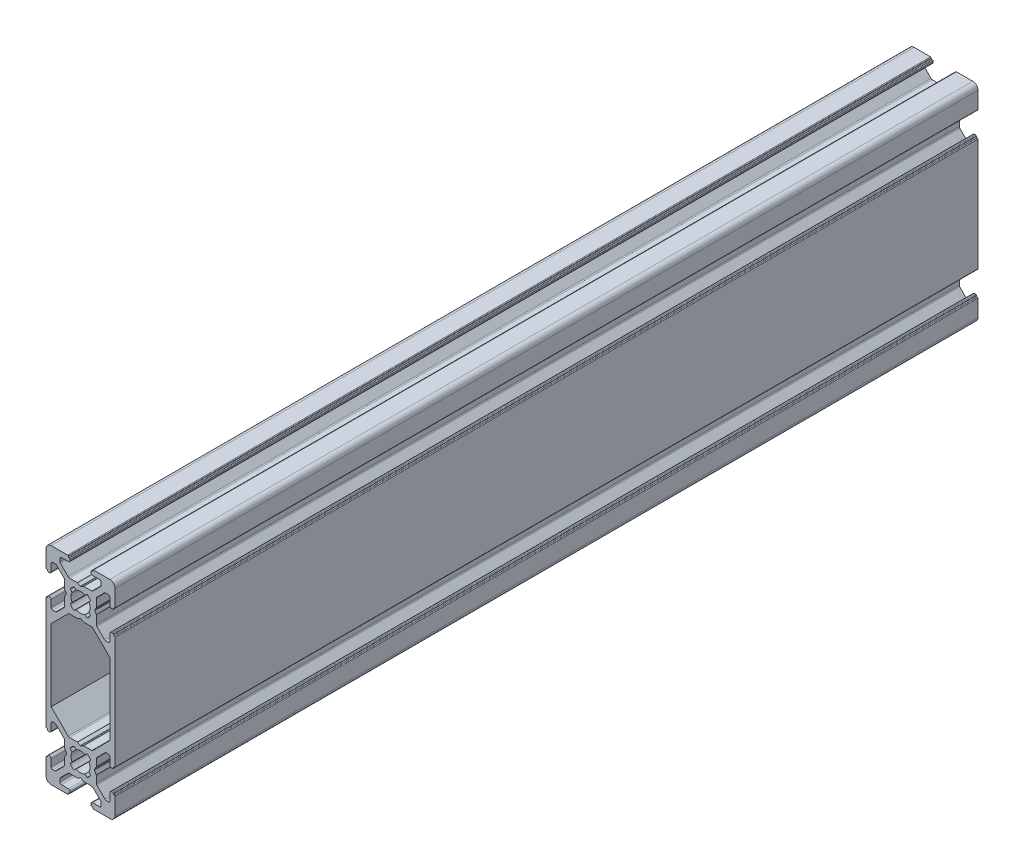
from build123d import *

# Parameters (mm, degrees)
EXTRUDE1_DEPTH = 250


with BuildPart() as part:
    # Sketch2 → Extrude1 (new body)
    with BuildSketch(Plane.XY):
        with BuildLine():
            Line((-9.99999992, 36.255782504), (-9.99999992, 8.499999759))
            Line((-9.99999992, 8.499999759), (-9.99999992, 3.75))
            ThreePointArc((-9.99999992, 3.75), (-9.941421276, 3.608578644), (-9.79999992, 3.55))
            Line((-9.79999992, 3.55), (-9.69999992, 3.55))
            ThreePointArc((-9.69999992, 3.55), (-9.558578564, 3.491421356), (-9.49999992, 3.35))
            Line((-9.49999992, 3.35), (-9.49999992, 3.2))
            ThreePointArc((-9.49999992, 3.2), (-9.441421276, 3.058578644), (-9.29999992, 3))
            Line((-9.29999992, 3), (-8.99999992, 3))
            ThreePointArc((-8.99999992, 3), (-8.646446529, 3.146446609), (-8.49999992, 3.5))
            Line((-8.49999992, 3.5), (-8.49999992, 5.5))
            ThreePointArc((-8.49999992, 5.5), (-8.353553311, 5.853553391), (-7.99999992, 6))
            Line((-7.99999992, 6), (-7.467766346, 6))
            ThreePointArc((-7.467766346, 6), (-7.27642463, 5.961939766), (-7.114212955, 5.853553391))
            Line((-7.114212955, 5.853553391), (-4.721446323, 3.460786758))
            ThreePointArc((-4.721446323, 3.460786758), (-4.613059947, 3.298575084), (-4.574999713, 3.107233367))
            Line((-4.574999713, 3.107233367), (-4.574999713, 1.083493192))
            ThreePointArc((-4.574999713, 1.083493192), (-4.568184878, 1.031729383), (-4.548204794, 0.983493192))
            Line((-4.548204794, 0.983493192), (-4.038119761, 0.1))
            ThreePointArc((-4.038119761, 0.1), (-4.011324842, 0), (-4.038119761, -0.1))
            Line((-4.038119761, -0.1), (-4.548204794, -0.983493192))
            ThreePointArc((-4.548204794, -0.983493192), (-4.568184878, -1.031729383), (-4.574999713, -1.083493192))
            Line((-4.574999713, -1.083493192), (-4.574999713, -3.107233367))
            ThreePointArc((-4.574999713, -3.107233367), (-4.613059947, -3.298575084), (-4.721446323, -3.460786758))
            Line((-4.721446323, -3.460786758), (-7.114212955, -5.853553391))
            ThreePointArc((-7.114212955, -5.853553391), (-7.27642463, -5.961939766), (-7.467766346, -6))
            Line((-7.467766346, -6), (-7.99999992, -6))
            ThreePointArc((-7.99999992, -6), (-8.353553311, -5.853553391), (-8.49999992, -5.5))
            Line((-8.49999992, -5.5), (-8.49999992, -3.5))
            ThreePointArc((-8.49999992, -3.5), (-8.646446529, -3.146446609), (-8.99999992, -3))
            Line((-8.99999992, -3), (-9.29999992, -3))
            ThreePointArc((-9.29999992, -3), (-9.441421276, -3.058578644), (-9.49999992, -3.2))
            Line((-9.49999992, -3.2), (-9.49999992, -3.35))
            ThreePointArc((-9.49999992, -3.35), (-9.558578564, -3.491421356), (-9.69999992, -3.55))
            Line((-9.69999992, -3.55), (-9.79999992, -3.55))
            ThreePointArc((-9.79999992, -3.55), (-9.941421276, -3.608578644), (-9.99999992, -3.75))
            Line((-9.99999992, -3.75), (-9.99999992, -8.5))
            ThreePointArc((-9.99999992, -8.5), (-9.560660092, -9.560660172), (-8.49999992, -10))
            Line((-8.49999992, -10), (-3.74999992, -10))
            ThreePointArc((-3.74999992, -10), (-3.608578564, -9.941421356), (-3.54999992, -9.8))
            Line((-3.54999992, -9.8), (-3.54999992, -9.7))
            ThreePointArc((-3.54999992, -9.7), (-3.491421276, -9.558578644), (-3.34999992, -9.5))
            Line((-3.34999992, -9.5), (-3.2, -9.5))
            ThreePointArc((-3.2, -9.5), (-3.058578644, -9.441421356), (-3, -9.3))
            Line((-3, -9.3), (-3, -9))
            ThreePointArc((-3, -9), (-3.146446609, -8.646446609), (-3.5, -8.5))
            Line((-3.5, -8.5), (-5.5, -8.5))
            ThreePointArc((-5.5, -8.5), (-5.853553391, -8.353553391), (-6, -8))
            Line((-6, -8), (-6, -7.267766929))
            ThreePointArc((-6, -7.267766929), (-5.961939766, -7.076425212), (-5.853553391, -6.914213538))
            Line((-5.853553391, -6.914213538), (-3.585786494, -4.646446642))
            ThreePointArc((-3.585786494, -4.646446642), (-3.42357482, -4.538060266), (-3.232233104, -4.500000032))
            Line((-3.232233104, -4.500000032), (-0.953589838, -4.500000032))
            ThreePointArc((-0.953589838, -4.500000032), (-0.901826029, -4.493185198), (-0.853589838, -4.473205113))
            Line((-0.853589838, -4.473205113), (-0.1, -4.038119817))
            ThreePointArc((-0.1, -4.038119817), (0, -4.011324898), (0.1, -4.038119817))
            Line((0.1, -4.038119817), (0.853589838, -4.473205113))
            ThreePointArc((0.853589838, -4.473205113), (0.901826029, -4.493185198), (0.953589838, -4.500000032))
            Line((0.953589838, -4.500000032), (3.232233104, -4.500000032))
            ThreePointArc((3.232233104, -4.500000032), (3.42357482, -4.538060266), (3.585786494, -4.646446642))
            Line((3.585786494, -4.646446642), (5.853553391, -6.914213538))
            ThreePointArc((5.853553391, -6.914213538), (5.961939766, -7.076425212), (6, -7.267766929))
            Line((6, -7.267766929), (6, -8))
            ThreePointArc((6, -8), (5.853553391, -8.353553391), (5.5, -8.5))
            Line((5.5, -8.5), (3.5, -8.5))
            ThreePointArc((3.5, -8.5), (3.146446609, -8.646446609), (3, -9))
            Line((3, -9), (3, -9.3))
            ThreePointArc((3, -9.3), (3.058578644, -9.441421356), (3.2, -9.5))
            Line((3.2, -9.5), (3.34999992, -9.5))
            ThreePointArc((3.34999992, -9.5), (3.491421276, -9.558578644), (3.54999992, -9.7))
            Line((3.54999992, -9.7), (3.54999992, -9.8))
            ThreePointArc((3.54999992, -9.8), (3.608578564, -9.941421356), (3.74999992, -10))
            Line((3.74999992, -10), (8.49999992, -10))
            ThreePointArc((8.49999992, -10), (9.560660092, -9.560660172), (9.99999992, -8.5))
            Line((9.99999992, -8.5), (9.99999992, -3.7))
            ThreePointArc((9.99999992, -3.7), (9.941421276, -3.558578644), (9.79999992, -3.5))
            Line((9.79999992, -3.5), (9.69999992, -3.5))
            ThreePointArc((9.69999992, -3.5), (9.558578564, -3.441421356), (9.49999992, -3.3))
            Line((9.49999992, -3.3), (9.49999992, -3.2))
            ThreePointArc((9.49999992, -3.2), (9.441421276, -3.058578644), (9.29999992, -3))
            Line((9.29999992, -3), (8.99999992, -3))
            ThreePointArc((8.99999992, -3), (8.646446529, -3.146446609), (8.49999992, -3.5))
            Line((8.49999992, -3.5), (8.49999992, -5.499999866))
            ThreePointArc((8.49999992, -5.499999866), (8.353553271, -5.853553351), (7.999999786, -6))
            Line((7.999999786, -6), (7.467766346, -6))
            ThreePointArc((7.467766346, -6), (7.27642463, -5.961939766), (7.114212955, -5.853553391))
            Line((7.114212955, -5.853553391), (4.721446323, -3.460786758))
            ThreePointArc((4.721446323, -3.460786758), (4.613059947, -3.298575084), (4.574999713, -3.107233367))
            Line((4.574999713, -3.107233367), (4.574999713, -1.083493446))
            ThreePointArc((4.574999713, -1.083493446), (4.568184878, -1.031729637), (4.548204794, -0.983493446))
            Line((4.548204794, -0.983493446), (4.038119615, -0.1))
            ThreePointArc((4.038119615, -0.1), (4.011324696, 0), (4.038119615, 0.1))
            Line((4.038119615, 0.1), (4.548204794, 0.983493446))
            ThreePointArc((4.548204794, 0.983493446), (4.568184878, 1.031729637), (4.574999713, 1.083493446))
            Line((4.574999713, 1.083493446), (4.574999713, 3.107233367))
            ThreePointArc((4.574999713, 3.107233367), (4.613059947, 3.298575084), (4.721446323, 3.460786758))
            Line((4.721446323, 3.460786758), (7.114212955, 5.853553391))
            ThreePointArc((7.114212955, 5.853553391), (7.27642463, 5.961939766), (7.467766346, 6))
            Line((7.467766346, 6), (7.999999786, 6))
            ThreePointArc((7.999999786, 6), (8.353553177, 5.853553391), (8.499999786, 5.5))
            Line((8.499999786, 5.5), (8.499999786, 3.5))
            ThreePointArc((8.499999786, 3.5), (8.646446395, 3.146446609), (8.999999786, 3))
            Line((8.999999786, 3), (9.299999961, 3))
            ThreePointArc((9.299999961, 3), (9.441421317, 3.058578644), (9.499999961, 3.2))
            Line((9.499999961, 3.2), (9.499999961, 3.3))
            ThreePointArc((9.499999961, 3.3), (9.558578605, 3.441421356), (9.699999961, 3.5))
            Line((9.699999961, 3.5), (9.79999992, 3.5))
            ThreePointArc((9.79999992, 3.5), (9.941421276, 3.558578644), (9.99999992, 3.7))
            Line((9.99999992, 3.7), (9.99999992, 8.500000326))
            Line((9.99999992, 8.500000326), (9.99999992, 36.255782504))
            ThreePointArc((9.99999992, 36.255782504), (9.941421276, 36.39720386), (9.79999992, 36.455782504))
            Line((9.79999992, 36.455782504), (9.69999992, 36.455782504))
            ThreePointArc((9.69999992, 36.455782504), (9.558578564, 36.514361147), (9.49999992, 36.655782504))
            Line((9.49999992, 36.655782504), (9.49999992, 36.755782504))
            ThreePointArc((9.49999992, 36.755782504), (9.441421276, 36.89720386), (9.29999992, 36.955782504))
            Line((9.29999992, 36.955782504), (8.99999992, 36.955782504))
            ThreePointArc((8.99999992, 36.955782504), (8.646446529, 36.809335894), (8.49999992, 36.455782504))
            Line((8.49999992, 36.455782504), (8.49999992, 34.505782744))
            ThreePointArc((8.49999992, 34.505782744), (8.353553311, 34.152229354), (7.99999992, 34.005782744))
            Line((7.99999992, 34.005782744), (7.267766873, 34.005782744))
            ThreePointArc((7.267766873, 34.005782744), (7.076425157, 34.043842978), (6.914213482, 34.152229354))
            Line((6.914213482, 34.152229354), (4.721446323, 36.344996513))
            ThreePointArc((4.721446323, 36.344996513), (4.613059947, 36.507208188), (4.574999713, 36.698549904))
            Line((4.574999713, 36.698549904), (4.574999713, 39.177192543))
            ThreePointArc((4.574999713, 39.177192543), (4.568184878, 39.228956354), (4.548204792, 39.277192547))
            Line((4.548204792, 39.277192547), (4.141986965, 39.980782422))
            ThreePointArc((4.141986965, 39.980782422), (4.115192043, 40.080782422), (4.14198696, 40.180782422))
            Line((4.14198696, 40.180782422), (4.548204796, 40.884372394))
            ThreePointArc((4.548204796, 40.884372394), (4.568184879, 40.932608583), (4.574999713, 40.98437239))
            Line((4.574999713, 40.98437239), (4.574999713, 43.313015505))
            ThreePointArc((4.574999713, 43.313015505), (4.613059942, 43.50435721), (4.721446305, 43.666568878))
            Line((4.721446305, 43.666568878), (6.914213331, 45.859336117))
            ThreePointArc((6.914213331, 45.859336117), (7.076425073, 45.967722531), (7.267766873, 46.005782744))
            Line((7.267766873, 46.005782744), (7.99999992, 46.005782744))
            ThreePointArc((7.99999992, 46.005782744), (8.353553311, 45.859336135), (8.49999992, 45.505782744))
            Line((8.49999992, 45.505782744), (8.49999992, 43.455782504))
            ThreePointArc((8.49999992, 43.455782504), (8.646446529, 43.102229113), (8.99999992, 42.955782504))
            Line((8.99999992, 42.955782504), (9.29999992, 42.955782504))
            ThreePointArc((9.29999992, 42.955782504), (9.441421276, 43.014361147), (9.49999992, 43.155782504))
            Line((9.49999992, 43.155782504), (9.49999992, 43.255782504))
            ThreePointArc((9.49999992, 43.255782504), (9.558578564, 43.39720386), (9.69999992, 43.455782504))
            Line((9.69999992, 43.455782504), (9.79999992, 43.455782504))
            ThreePointArc((9.79999992, 43.455782504), (9.941421276, 43.514361147), (9.99999992, 43.655782504))
            Line((9.99999992, 43.655782504), (9.99999992, 48.49999967))
            ThreePointArc((9.99999992, 48.49999967), (9.560660092, 49.560659842), (8.49999992, 49.99999967))
            Line((8.49999992, 49.99999967), (3.74999992, 49.99999967))
            ThreePointArc((3.74999992, 49.99999967), (3.608578564, 49.941421026), (3.54999992, 49.79999967))
            Line((3.54999992, 49.79999967), (3.54999992, 49.69999967))
            ThreePointArc((3.54999992, 49.69999967), (3.491421276, 49.558578314), (3.34999992, 49.49999967))
            Line((3.34999992, 49.49999967), (3.2, 49.49999967))
            ThreePointArc((3.2, 49.49999967), (3.058578644, 49.441421026), (3, 49.29999967))
            Line((3, 49.29999967), (3, 48.99999967))
            ThreePointArc((3, 48.99999967), (3.146446609, 48.646446279), (3.5, 48.49999967))
            Line((3.5, 48.49999967), (5.5, 48.49999967))
            ThreePointArc((5.5, 48.49999967), (5.853553391, 48.353553061), (6, 47.99999967))
            Line((6, 47.99999967), (6, 47.267766623))
            ThreePointArc((6, 47.267766623), (5.961939766, 47.076424907), (5.853553391, 46.914213232))
            Line((5.853553391, 46.914213232), (3.585786494, 44.646446336))
            ThreePointArc((3.585786494, 44.646446336), (3.42357482, 44.538059961), (3.232233104, 44.499999727))
            Line((3.232233104, 44.499999727), (0.953589697, 44.499999727))
            ThreePointArc((0.953589697, 44.499999727), (0.901825886, 44.493184891), (0.853589693, 44.473204805))
            Line((0.853589693, 44.473204805), (0.059202738, 44.014565257))
            ThreePointArc((0.059202738, 44.014565257), (0, 43.998701931), (-0.059202738, 44.014565257))
            Line((-0.059202738, 44.014565257), (-0.853589693, 44.473204805))
            ThreePointArc((-0.853589693, 44.473204805), (-0.901825886, 44.493184891), (-0.953589697, 44.499999727))
            Line((-0.953589697, 44.499999727), (-3.232233104, 44.499999727))
            ThreePointArc((-3.232233104, 44.499999727), (-3.42357482, 44.538059961), (-3.585786494, 44.646446336))
            Line((-3.585786494, 44.646446336), (-5.853553391, 46.914213232))
            ThreePointArc((-5.853553391, 46.914213232), (-5.961939766, 47.076424907), (-6, 47.267766623))
            Line((-6, 47.267766623), (-6, 47.99999967))
            ThreePointArc((-6, 47.99999967), (-5.853553391, 48.353553061), (-5.5, 48.49999967))
            Line((-5.5, 48.49999967), (-3.5, 48.49999967))
            ThreePointArc((-3.5, 48.49999967), (-3.146446609, 48.646446279), (-3, 48.99999967))
            Line((-3, 48.99999967), (-3, 49.29999967))
            ThreePointArc((-3, 49.29999967), (-3.058578644, 49.441421026), (-3.2, 49.49999967))
            Line((-3.2, 49.49999967), (-3.34999992, 49.49999967))
            ThreePointArc((-3.34999992, 49.49999967), (-3.491421276, 49.558578314), (-3.54999992, 49.69999967))
            Line((-3.54999992, 49.69999967), (-3.54999992, 49.79999967))
            ThreePointArc((-3.54999992, 49.79999967), (-3.608578564, 49.941421026), (-3.74999992, 49.99999967))
            Line((-3.74999992, 49.99999967), (-8.49999992, 49.99999967))
            ThreePointArc((-8.49999992, 49.99999967), (-9.560660092, 49.560659842), (-9.99999992, 48.49999967))
            Line((-9.99999992, 48.49999967), (-9.99999992, 43.655782504))
            ThreePointArc((-9.99999992, 43.655782504), (-9.941421276, 43.514361147), (-9.79999992, 43.455782504))
            Line((-9.79999992, 43.455782504), (-9.69999992, 43.455782504))
            ThreePointArc((-9.69999992, 43.455782504), (-9.558578564, 43.39720386), (-9.49999992, 43.255782504))
            Line((-9.49999992, 43.255782504), (-9.49999992, 43.155782504))
            ThreePointArc((-9.49999992, 43.155782504), (-9.441421276, 43.014361147), (-9.29999992, 42.955782504))
            Line((-9.29999992, 42.955782504), (-8.99999992, 42.955782504))
            ThreePointArc((-8.99999992, 42.955782504), (-8.646446529, 43.102229113), (-8.49999992, 43.455782504))
            Line((-8.49999992, 43.455782504), (-8.49999992, 45.50578261))
            ThreePointArc((-8.49999992, 45.50578261), (-8.353553271, 45.859336095), (-7.999999786, 46.005782744))
            Line((-7.999999786, 46.005782744), (-7.267766739, 46.005782744))
            ThreePointArc((-7.267766739, 46.005782744), (-7.076425012, 45.967722506), (-6.914213331, 45.859336117))
            Line((-6.914213331, 45.859336117), (-4.721446305, 43.666568878))
            ThreePointArc((-4.721446305, 43.666568878), (-4.613059942, 43.50435721), (-4.574999713, 43.313015505))
            Line((-4.574999713, 43.313015505), (-4.574999713, 40.98437239))
            ThreePointArc((-4.574999713, 40.98437239), (-4.568184879, 40.932608583), (-4.548204796, 40.884372394))
            Line((-4.548204796, 40.884372394), (-4.14198696, 40.180782422))
            ThreePointArc((-4.14198696, 40.180782422), (-4.115192043, 40.080782422), (-4.141986965, 39.980782422))
            Line((-4.141986965, 39.980782422), (-4.548204792, 39.277192547))
            ThreePointArc((-4.548204792, 39.277192547), (-4.568184878, 39.228956354), (-4.574999713, 39.177192543))
            Line((-4.574999713, 39.177192543), (-4.574999713, 36.698549904))
            ThreePointArc((-4.574999713, 36.698549904), (-4.613059947, 36.507208188), (-4.721446323, 36.344996513))
            Line((-4.721446323, 36.344996513), (-6.914213482, 34.152229354))
            ThreePointArc((-6.914213482, 34.152229354), (-7.076425157, 34.043842978), (-7.267766873, 34.005782744))
            Line((-7.267766873, 34.005782744), (-7.99999992, 34.005782744))
            ThreePointArc((-7.99999992, 34.005782744), (-8.353553311, 34.152229354), (-8.49999992, 34.505782744))
            Line((-8.49999992, 34.505782744), (-8.49999992, 36.455782504))
            ThreePointArc((-8.49999992, 36.455782504), (-8.646446529, 36.809335894), (-8.99999992, 36.955782504))
            Line((-8.99999992, 36.955782504), (-9.29999992, 36.955782504))
            ThreePointArc((-9.29999992, 36.955782504), (-9.441421276, 36.89720386), (-9.49999992, 36.755782504))
            Line((-9.49999992, 36.755782504), (-9.49999992, 36.655782504))
            ThreePointArc((-9.49999992, 36.655782504), (-9.558578564, 36.514361147), (-9.69999992, 36.455782504))
            Line((-9.69999992, 36.455782504), (-9.79999992, 36.455782504))
            ThreePointArc((-9.79999992, 36.455782504), (-9.941421276, 36.39720386), (-9.99999992, 36.255782504))
        make_face()
        with BuildLine():
            Line((-8.49999992, 30.445123452), (-8.49999992, 9.560660172))
            Line((-8.49999992, 9.560660172), (-3.585786414, 4.646446666))
            ThreePointArc((-3.585786414, 4.646446666), (-3.42357474, 4.538060291), (-3.232233024, 4.500000057))
            Line((-3.232233024, 4.500000057), (-0.953589617, 4.500000057))
            ThreePointArc((-0.953589617, 4.500000057), (-0.901825806, 4.493185221), (-0.853589613, 4.473205135))
            Line((-0.853589613, 4.473205135), (-0.099999785, 4.038119821))
            ThreePointArc((-0.099999785, 4.038119821), (1.27e-07, 4.011325026), (0.100000004, 4.038119947))
            Line((0.100000004, 4.038119947), (0.853589613, 4.473205135))
            ThreePointArc((0.853589613, 4.473205135), (0.901825806, 4.493185221), (0.953589617, 4.500000057))
            Line((0.953589617, 4.500000057), (3.232233024, 4.500000057))
            ThreePointArc((3.232233024, 4.500000057), (3.42357474, 4.538060291), (3.585786414, 4.646446666))
            Line((3.585786414, 4.646446666), (8.49999992, 9.560660172))
            Line((8.49999992, 9.560660172), (8.49999992, 30.445123452))
            Line((8.49999992, 30.445123452), (3.585786641, 35.359336253))
            ThreePointArc((3.585786641, 35.359336253), (3.423574972, 35.467722616), (3.232233267, 35.505782845))
            Line((3.232233267, 35.505782845), (0.953589841, 35.505782845))
            ThreePointArc((0.953589841, 35.505782845), (0.901826034, 35.512597679), (0.853589845, 35.532577762))
            Line((0.853589845, 35.532577762), (0.099999996, 35.967663039))
            ThreePointArc((0.099999996, 35.967663039), (0, 35.994457956), (-0.099999996, 35.967663039))
            Line((-0.099999996, 35.967663039), (-0.853589845, 35.532577762))
            ThreePointArc((-0.853589845, 35.532577762), (-0.901826034, 35.512597679), (-0.953589841, 35.505782845))
            Line((-0.953589841, 35.505782845), (-3.232233267, 35.505782845))
            ThreePointArc((-3.232233267, 35.505782845), (-3.423574972, 35.467722616), (-3.585786641, 35.359336253))
            Line((-3.585786641, 35.359336253), (-8.49999992, 30.445123452))
        make_face(mode=Mode.SUBTRACT)
        with BuildLine():
            Line((1.258185436, 2.445295362), (1.909931107, 2.99217486))
            ThreePointArc((1.909931107, 2.99217486), (2.508410608, 2.511737138), (2.989641056, 1.913894874))
            Line((2.989641056, 1.913894874), (2.445295423, 1.258185317))
            ThreePointArc((2.445295423, 1.258185317), (2.75, -6.7e-08), (2.445295362, -1.258185436))
            Line((2.445295362, -1.258185436), (2.99217486, -1.909931107))
            ThreePointArc((2.99217486, -1.909931107), (2.511722921, -2.508424844), (1.913860983, -2.989662751))
            Line((1.913860983, -2.989662751), (1.262349172, -2.443148495))
            ThreePointArc((1.262349172, -2.443148495), (0.002342314, -2.749999002), (-1.258185436, -2.445295362))
            Line((-1.258185436, -2.445295362), (-1.909931107, -2.99217486))
            ThreePointArc((-1.909931107, -2.99217486), (-2.508424844, -2.511722921), (-2.989662751, -1.913860983))
            Line((-2.989662751, -1.913860983), (-2.443148495, -1.262349172))
            ThreePointArc((-2.443148495, -1.262349172), (-2.749999002, -0.002342314), (-2.445295362, 1.258185436))
            Line((-2.445295362, 1.258185436), (-2.99217486, 1.909931107))
            ThreePointArc((-2.99217486, 1.909931107), (-2.511737138, 2.508410608), (-1.913894874, 2.989641056))
            Line((-1.913894874, 2.989641056), (-1.262349172, 2.443148495))
            ThreePointArc((-1.262349172, 2.443148495), (-0.002342314, 2.749999002), (1.258185436, 2.445295362))
        make_face(mode=Mode.SUBTRACT)
        with BuildLine():
            Line((1.258185317, 37.560487321), (1.887054865, 37.058067708))
            ThreePointArc((1.887054865, 37.058067708), (2.474873674, 37.53090895), (2.947714945, 38.118727736))
            Line((2.947714945, 38.118727736), (2.445295362, 38.747597308))
            ThreePointArc((2.445295362, 38.747597308), (2.75, 40.005782677), (2.445295423, 41.263968061))
            Line((2.445295423, 41.263968061), (2.947715037, 41.892837609))
            ThreePointArc((2.947715037, 41.892837609), (2.474873794, 42.480656418), (1.887055008, 42.953497689))
            Line((1.887055008, 42.953497689), (1.258185436, 42.451078106))
            ThreePointArc((1.258185436, 42.451078106), (6.7e-08, 42.755782744), (-1.258185317, 42.451078168))
            Line((-1.258185317, 42.451078168), (-1.887054865, 42.953497781))
            ThreePointArc((-1.887054865, 42.953497781), (-2.474873674, 42.480656539), (-2.947714945, 41.892837753))
            Line((-2.947714945, 41.892837753), (-2.445295362, 41.26396818))
            ThreePointArc((-2.445295362, 41.26396818), (-2.75, 40.005782811), (-2.445295423, 38.747597427))
            Line((-2.445295423, 38.747597427), (-2.947715037, 38.118727879))
            ThreePointArc((-2.947715037, 38.118727879), (-2.474873794, 37.53090907), (-1.887055008, 37.058067799))
            Line((-1.887055008, 37.058067799), (-1.258185436, 37.560487382))
            ThreePointArc((-1.258185436, 37.560487382), (-6.7e-08, 37.255782744), (1.258185317, 37.560487321))
        make_face(mode=Mode.SUBTRACT)
    extrude(amount=EXTRUDE1_DEPTH)


solid = part.part
